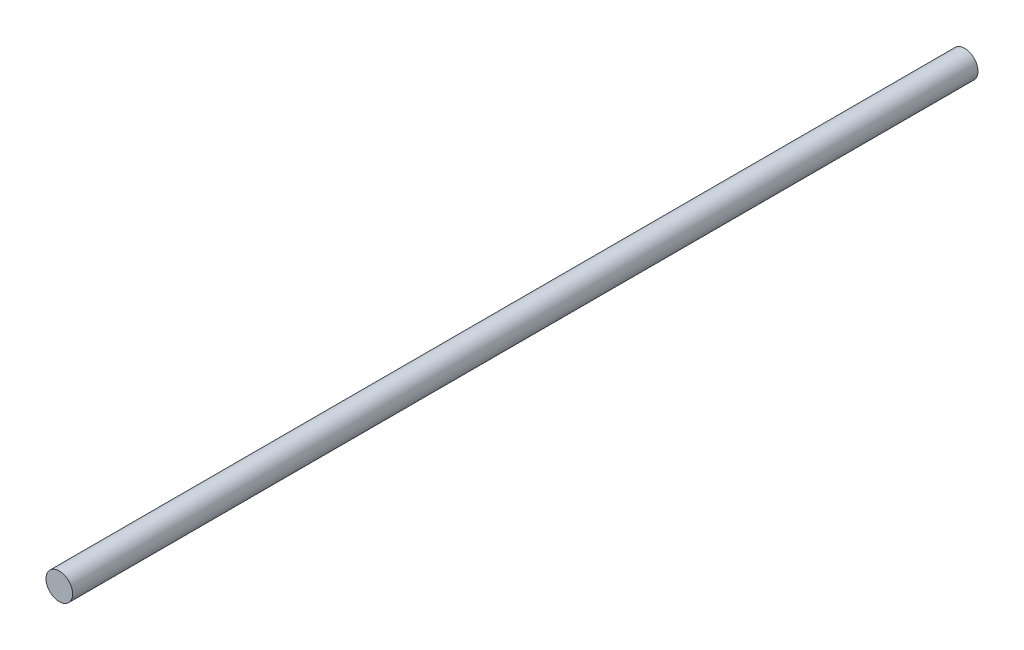
from build123d import *

# Parameters (mm, degrees)
ESQUISSE1_R        = 5
BOSS_EXTRU_1_DEPTH = 340


with BuildPart() as part:
    # Esquisse1 → Boss.-Extru.1 (new body)
    with BuildSketch(Plane.XY):
        Circle(ESQUISSE1_R)
    extrude(amount=BOSS_EXTRU_1_DEPTH)


solid = part.part
